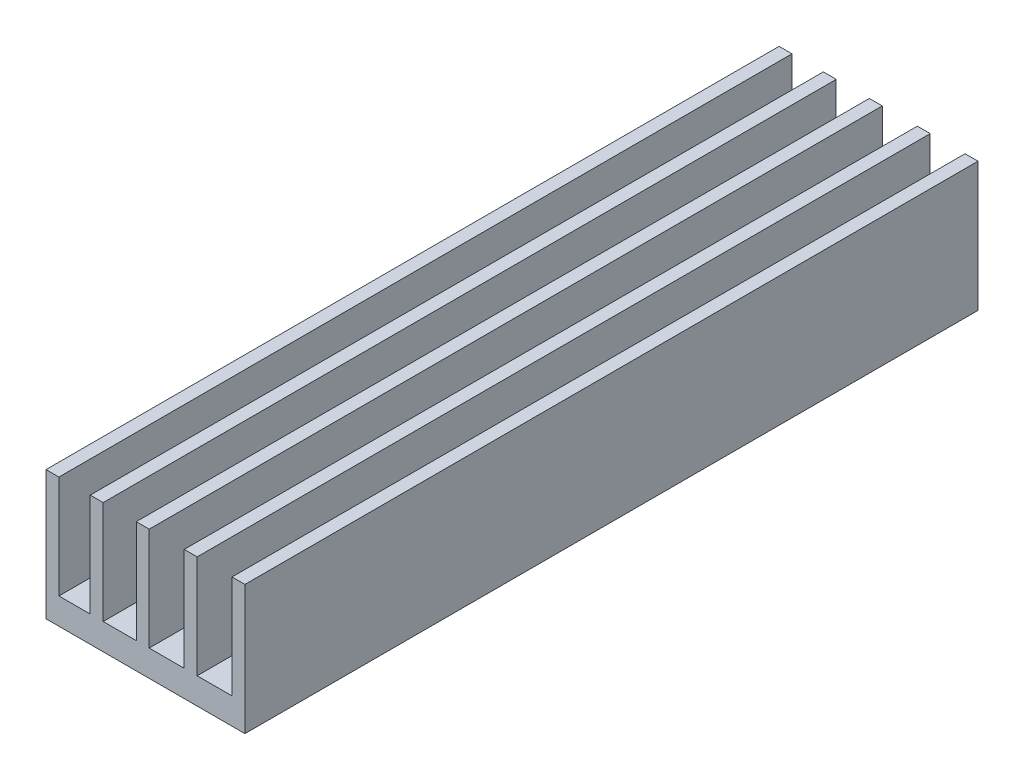
from build123d import *

# Parameters (mm, degrees)
EXTRUDE1_DEPTH            = 92.202
F_4_40_TAPPED_HOLE1_D     = 2.2606
F_4_40_TAPPED_HOLE1_DEPTH = 7.5946
F_4_40_TAPPED_HOLE1_TIP   = 0.679152758


with BuildPart() as part:
    # Sketch1 → Extrude1 (new body)
    with BuildSketch(Plane.XY):
        Polygon((0, 0), (25.019, 0), (25.019, 16.256), (23.3934, 16.256), (23.3934, 3.302), (19.013003595, 3.302), (19.013003595, 16.256), (17.387403595, 16.256), (17.387403595, 3.302), (12.97763135, 3.302), (12.97763135, 16.256), (11.35203135, 16.256), (11.35203135, 3.302), (7.190288103, 3.302), (7.190288103, 16.256), (5.564688103, 16.256), (5.564688103, 3.302), (1.6256, 3.302), (1.6256, 16.256), (0, 16.256), align=None)
    extrude(amount=-EXTRUDE1_DEPTH)

    # #4-40 Tapped Hole1
    with Locations(Plane.XZ):
        with Locations((9.525, -25.4), (9.525, -78.74)):
            Hole(F_4_40_TAPPED_HOLE1_D / 2, depth=F_4_40_TAPPED_HOLE1_DEPTH)
            with Locations((0, 0, -(F_4_40_TAPPED_HOLE1_DEPTH + F_4_40_TAPPED_HOLE1_TIP / 2))):  # 118° drill point
                Cone(0, F_4_40_TAPPED_HOLE1_D / 2, F_4_40_TAPPED_HOLE1_TIP, mode=Mode.SUBTRACT)


solid = part.part
